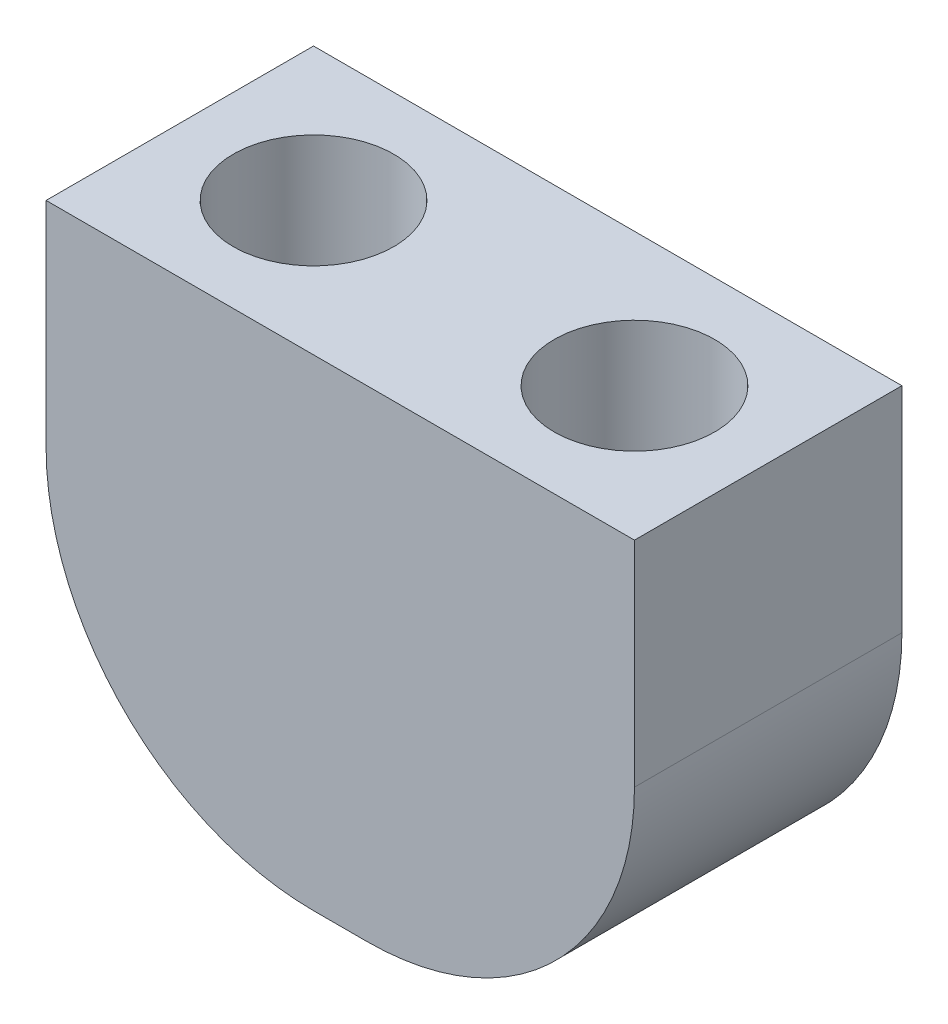
from build123d import *

# Parameters (mm, degrees)
SKETCH1_W           = 22
SKETCH1_H           = 10
BOSS_EXTRUDE1_DEPTH = 28
SKETCH2_R           = 3
CUT_EXTRUDE2_DEPTH  = 5
SKETCH4_W           = 22
SKETCH4_H           = 10
CUT_EXTRUDE4_DEPTH  = 32.701734968
SKETCH5_R           = 5
CUT_EXTRUDE5_DEPTH  = 5
FILLET2_R           = 10


with BuildPart() as part:
    # Sketch1 → Boss-Extrude1 (new body)
    with BuildSketch(Plane(origin=(0, 0, 0), x_dir=(1, 0, 0), z_dir=(0, 1, 0))):
        Rectangle(SKETCH1_W, SKETCH1_H)
    extrude(amount=BOSS_EXTRUDE1_DEPTH)

    # Sketch2 → Cut-Extrude2 (cut)
    with BuildSketch(Plane(origin=(0, 28, 0), x_dir=(1, 0, 0), z_dir=(0, 1, 0))):
        with Locations(Location((-6, 0, 0), (0, 0, 270))):
            Circle(SKETCH2_R)
        with Locations(Location((6, 0, 0), (0, 0, 270))):
            Circle(SKETCH2_R)
    extrude(amount=-CUT_EXTRUDE2_DEPTH, mode=Mode.SUBTRACT)

    # Sketch4 → Cut-Extrude4 (cut, through all)
    with BuildSketch(Plane(origin=(0, 0, -5), x_dir=(-1, 0, 0), z_dir=(0, 0, -1))):
        with Locations((0, 5)):
            Rectangle(SKETCH4_W, SKETCH4_H)
    extrude(amount=-CUT_EXTRUDE4_DEPTH, mode=Mode.SUBTRACT)

    # Sketch5 → Cut-Extrude5 (cut)
    with BuildSketch(Plane(origin=(0, 0, -5), x_dir=(-1, 0, 0), z_dir=(0, 0, -1))):
        with Locations((0, 17)):
            Circle(SKETCH5_R)
    extrude(amount=-CUT_EXTRUDE5_DEPTH, mode=Mode.SUBTRACT)

    # Fillet2
    fillet2_edges = [part.edges().sort_by_distance(p)[0] for p in [
        (-11, 10, 0),
        (11, 10, 0),
    ]]
    fillet(fillet2_edges, radius=FILLET2_R)


solid = part.part
